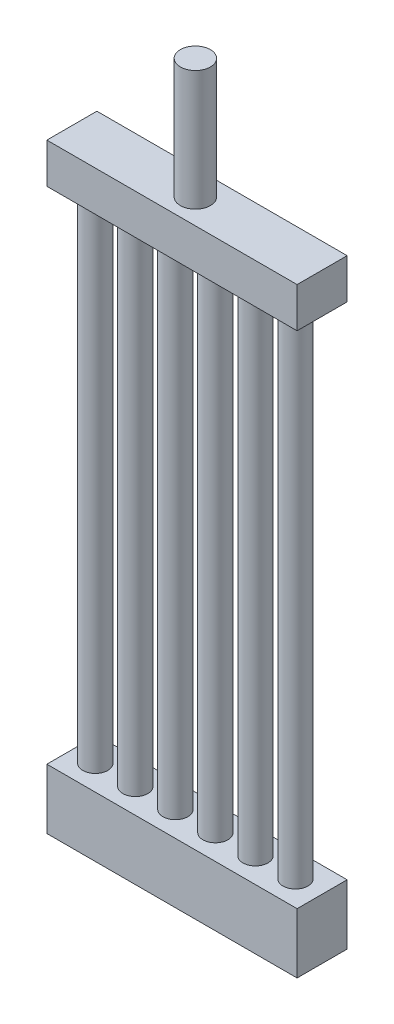
from build123d import *

# Parameters (mm, degrees)
CROSSHEAD_START    = 54
SKETCH1_W          = 5
SKETCH1_H          = 6
CROSSHEAD_DEPTH    = 25
SMA_SPRING1_START  = 196
SKETCH2_R          = 1.25
SMA_SPRING1_DEPTH  = 50
SMA_SPRING2_START  = 196
SKETCH3_R          = 1.25
SMA_SPRING2_DEPTH  = 50
SMA_SPRING3_START  = 196
SKETCH4_R          = 1.25
SMA_SPRING3_DEPTH  = 50
SMA_SPRING4_START  = 196
SKETCH5_R          = 1.25
SMA_SPRING4_DEPTH  = 50
SMA_SPRING5_START  = 196
SKETCH6_R          = 1.25
SMA_SPRING5_DEPTH  = 50
SMA_SPRING6_START  = 196
SKETCH7_R          = 1.25
SMA_SPRING6_DEPTH  = 50
ANCHOR_PLATE_START = 54
SKETCH8_W          = 5
SKETCH8_H          = 4
ANCHOR_PLATE_DEPTH = 25
HOOK_START         = 250
SKETCH9_R          = 1.5
HOOK_DEPTH         = 12


with BuildPart() as part:
    # Sketch1 → crosshead (new body)
    with BuildSketch(Plane(origin=(0, 0, 0), x_dir=(0, 0, -1), z_dir=(1, 0, 0)).offset(CROSSHEAD_START)):
        with Locations((-36.5, 193)):
            Rectangle(SKETCH1_W, SKETCH1_H)
    extrude(amount=CROSSHEAD_DEPTH)


with BuildPart() as body_2:
    # Sketch2 → sma_spring1 (new body)
    with BuildSketch(Plane(origin=(0, 0, 0), x_dir=(1, 0, 0), z_dir=(0, 1, 0)).offset(SMA_SPRING1_START)):
        with Locations(Location((56.34, -36.5, 0), (0, 0, 270))):
            Circle(SKETCH2_R)
    extrude(amount=SMA_SPRING1_DEPTH)


with BuildPart() as body_3:
    # Sketch3 → sma_spring2 (new body)
    with BuildSketch(Plane(origin=(0, 0, 0), x_dir=(1, 0, 0), z_dir=(0, 1, 0)).offset(SMA_SPRING2_START)):
        with Locations(Location((60.34, -36.5, 0), (0, 0, 270))):
            Circle(SKETCH3_R)
    extrude(amount=SMA_SPRING2_DEPTH)


with BuildPart() as body_4:
    # Sketch4 → sma_spring3 (new body)
    with BuildSketch(Plane(origin=(0, 0, 0), x_dir=(1, 0, 0), z_dir=(0, 1, 0)).offset(SMA_SPRING3_START)):
        with Locations(Location((64.34, -36.5, 0), (0, 0, 270))):
            Circle(SKETCH4_R)
    extrude(amount=SMA_SPRING3_DEPTH)


with BuildPart() as body_5:
    # Sketch5 → sma_spring4 (new body)
    with BuildSketch(Plane(origin=(0, 0, 0), x_dir=(1, 0, 0), z_dir=(0, 1, 0)).offset(SMA_SPRING4_START)):
        with Locations(Location((68.34, -36.5, 0), (0, 0, 270))):
            Circle(SKETCH5_R)
    extrude(amount=SMA_SPRING4_DEPTH)


with BuildPart() as body_6:
    # Sketch6 → sma_spring5 (new body)
    with BuildSketch(Plane(origin=(0, 0, 0), x_dir=(1, 0, 0), z_dir=(0, 1, 0)).offset(SMA_SPRING5_START)):
        with Locations(Location((72.34, -36.5, 0), (0, 0, 270))):
            Circle(SKETCH6_R)
    extrude(amount=SMA_SPRING5_DEPTH)


with BuildPart() as body_7:
    # Sketch7 → sma_spring6 (new body)
    with BuildSketch(Plane(origin=(0, 0, 0), x_dir=(1, 0, 0), z_dir=(0, 1, 0)).offset(SMA_SPRING6_START)):
        with Locations(Location((76.34, -36.5, 0), (0, 0, 270))):
            Circle(SKETCH7_R)
    extrude(amount=SMA_SPRING6_DEPTH)


with BuildPart() as body_8:
    # Sketch8 → anchor_plate (new body)
    with BuildSketch(Plane(origin=(0, 0, 0), x_dir=(0, 0, -1), z_dir=(1, 0, 0)).offset(ANCHOR_PLATE_START)):
        with Locations((-36.5, 248)):
            Rectangle(SKETCH8_W, SKETCH8_H)
    extrude(amount=ANCHOR_PLATE_DEPTH)


with BuildPart() as body_9:
    # Sketch9 → hook (new body)
    with BuildSketch(Plane(origin=(0, 0, 0), x_dir=(1, 0, 0), z_dir=(0, 1, 0)).offset(HOOK_START)):
        with Locations(Location((66.34, -36.5, 0), (0, 0, 270))):
            Circle(SKETCH9_R)
    extrude(amount=HOOK_DEPTH)


solid = Compound([part.part, body_2.part, body_3.part, body_4.part, body_5.part, body_6.part, body_7.part, body_8.part, body_9.part])
